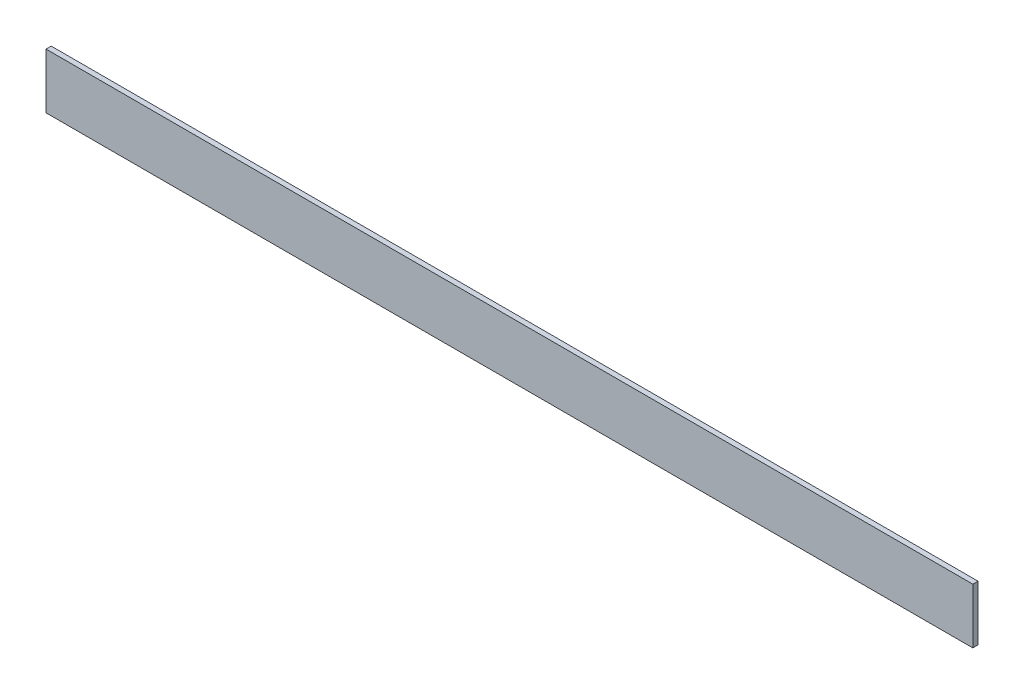
from build123d import *

# Parameters (mm, degrees)
SKETCH1_W           = 1704.975
SKETCH1_H           = 101.6
BOSS_EXTRUDE1_DEPTH = 9.525


with BuildPart() as part:
    # Sketch1 → Boss-Extrude1 (new body)
    with BuildSketch(Plane.XY):
        Rectangle(SKETCH1_W, SKETCH1_H)
    extrude(amount=BOSS_EXTRUDE1_DEPTH)


solid = part.part
